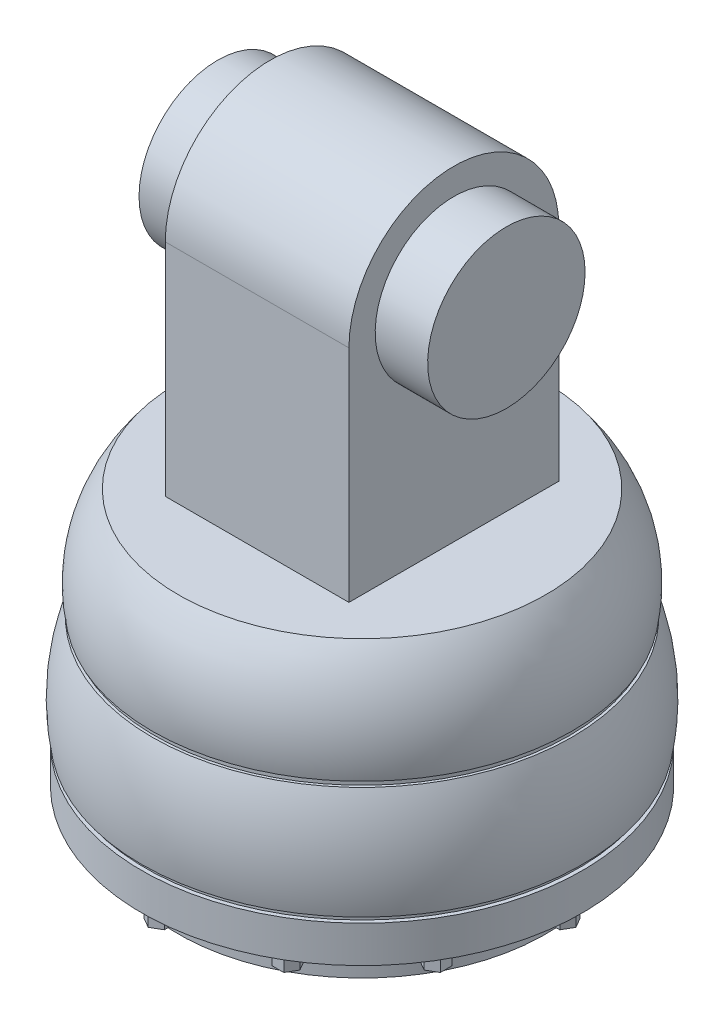
from build123d import *

# Parameters (mm, degrees)
ESQUISSE2_R                  = 39.5
BOSS_EXTRU_1_DEPTH           = 1
ESQUISSE4_R                  = 41.25
BOSS_EXTRU_2_DEPTH           = 1
ESQUISSE5_R                  = 42
BOSS_EXTRU_3_DEPTH           = 7
ESQUISSE6_R                  = 35
BOSS_EXTRU_4_DEPTH           = 7
BOSS_EXTRU_5_DEPTH           = 3
R_P_TITION_CIRCULAIRE1_COUNT = 12
ESQUISSE8_R                  = 15
BOSS_EXTRU_6_DEPTH           = 10
ESQUISSE9_W                  = 35
ESQUISSE9_H                  = 40
BOSS_EXTRU_7_DEPTH           = 42
BOSS_EXTRU_8_DEPTH           = 35
ESQUISSE11_R                 = 15
BOSS_EXTRU_9_DEPTH           = 10
BOSS_EXTRU_10_START          = 10
ESQUISSE12_R                 = 15
BOSS_EXTRU_10_DEPTH          = 10


with BuildPart() as part:
    # Esquisse1 → Révolution1 (revolve)
    with BuildSketch(Plane.XY):
        with BuildLine():
            Line((-35, 0), (0, 0))
            Line((0, 0), (0, -20))
            Line((0, -20), (-40, -20))
            ThreePointArc((-40, -20), (-39.657515479, -9.46062113), (-35, 0))
        make_face()
    revolve(axis=Axis((0, 0, 0), (0, -1, 0)))

    # Esquisse2 → Boss.-Extru.1 (add)
    with BuildSketch(Plane.XZ.offset(20)):
        Circle(ESQUISSE2_R)
    extrude(amount=BOSS_EXTRU_1_DEPTH)

    # Esquisse3 → Révolution2 (revolve)
    with BuildSketch(Plane(origin=(0, 0, 0), x_dir=(0, 0, -1), z_dir=(1, 0, 0)), mode=Mode.PRIVATE) as r_volution2_sk:
        with BuildLine():
            Line((0, -21), (-40, -21))
            ThreePointArc((-40, -21), (-42.384109041, -30.861589096), (-42, -41))
            Line((-42, -41), (0, -41))
            Line((0, -41), (0, -21))
        make_face()
    revolve(r_volution2_sk.sketch.rotate(Axis((0, -21, 0), (0, -1, 0)), 90), axis=Axis((0, -21, 0), (0, -1, 0)))

    # Esquisse4 → Boss.-Extru.2 (add)
    with BuildSketch(Plane.XZ.offset(41)):
        with Locations(Location((0, 0, 0), (0, 0, 270))):
            Circle(ESQUISSE4_R)
    extrude(amount=BOSS_EXTRU_2_DEPTH)

    # Esquisse5 → Boss.-Extru.3 (add)
    with BuildSketch(Plane.XZ.offset(42)):
        with Locations(Location((0, 0, 0), (0, 0, 270))):
            Circle(ESQUISSE5_R)
    extrude(amount=BOSS_EXTRU_3_DEPTH)

    # Esquisse6 → Boss.-Extru.4 (add)
    with BuildSketch(Plane.XZ.offset(49)):
        with Locations(Location((0, 0, 0), (0, 0, 270))):
            Circle(ESQUISSE6_R)
    extrude(amount=BOSS_EXTRU_4_DEPTH)

    # Esquisse7 → Boss.-Extru.5 (add)
    with BuildSketch(Plane.XZ.offset(49)):
        Polygon((40.75, 0), (39.625, 1.948557159), (37.375, 1.948557159), (36.25, 0), (37.375, -1.948557159), (39.625, -1.948557159), align=None)
        Polygon((39.595299462, 0), (39.047649731, 0.948557159), (37.952350269, 0.948557159), (37.404700538, 0), (37.952350269, -0.948557159), (39.047649731, -0.948557159), align=None, mode=Mode.SUBTRACT)
    boss_extru_5 = extrude(amount=BOSS_EXTRU_5_DEPTH)

    # Répétition circulaire1: Boss.-Extru.5 ×12 about axis
    r_p_tition_circulaire1_axis = Axis((0, 0, 0), (0, 1, 0))
    for i in range(1, R_P_TITION_CIRCULAIRE1_COUNT):
        add(boss_extru_5.rotate(r_p_tition_circulaire1_axis, i * 360 / R_P_TITION_CIRCULAIRE1_COUNT))

    # Esquisse8 → Boss.-Extru.6 (add)
    with BuildSketch(Plane.XZ.offset(56)):
        with Locations(Location((0, 0, 0), (0, 0, 270))):
            Circle(ESQUISSE8_R)
    extrude(amount=BOSS_EXTRU_6_DEPTH)

    # Esquisse9 → Boss.-Extru.7 (add)
    with BuildSketch(Plane(origin=(0, 0, 0), x_dir=(1, 0, 0), z_dir=(0, 1, 0))):
        Rectangle(ESQUISSE9_W, ESQUISSE9_H)
    extrude(amount=BOSS_EXTRU_7_DEPTH)

    # Esquisse10 → Boss.-Extru.8 (add)
    with BuildSketch(Plane.ZY.offset(17.5)):
        with BuildLine():
            ThreePointArc((20, 42), (0, 62), (-20, 42))
            Line((-20, 42), (20, 42))
        make_face()
    extrude(amount=-BOSS_EXTRU_8_DEPTH)

    # Esquisse11 → Boss.-Extru.9 (add)
    with BuildSketch(Plane.ZY.offset(17.5)):
        with Locations(Location((0, 42, 0), (0, 0, 90))):
            Circle(ESQUISSE11_R)
    extrude(amount=BOSS_EXTRU_9_DEPTH)

    # Esquisse12 → Boss.-Extru.10 (add)
    with BuildSketch(Plane(origin=(17.5, 0, 0), x_dir=(0, 0, -1), z_dir=(1, 0, 0)).offset(BOSS_EXTRU_10_START)):
        with Locations(Location((0, 42, 0), (0, 0, 90))):
            Circle(ESQUISSE12_R)
    extrude(amount=-BOSS_EXTRU_10_DEPTH)


solid = part.part
